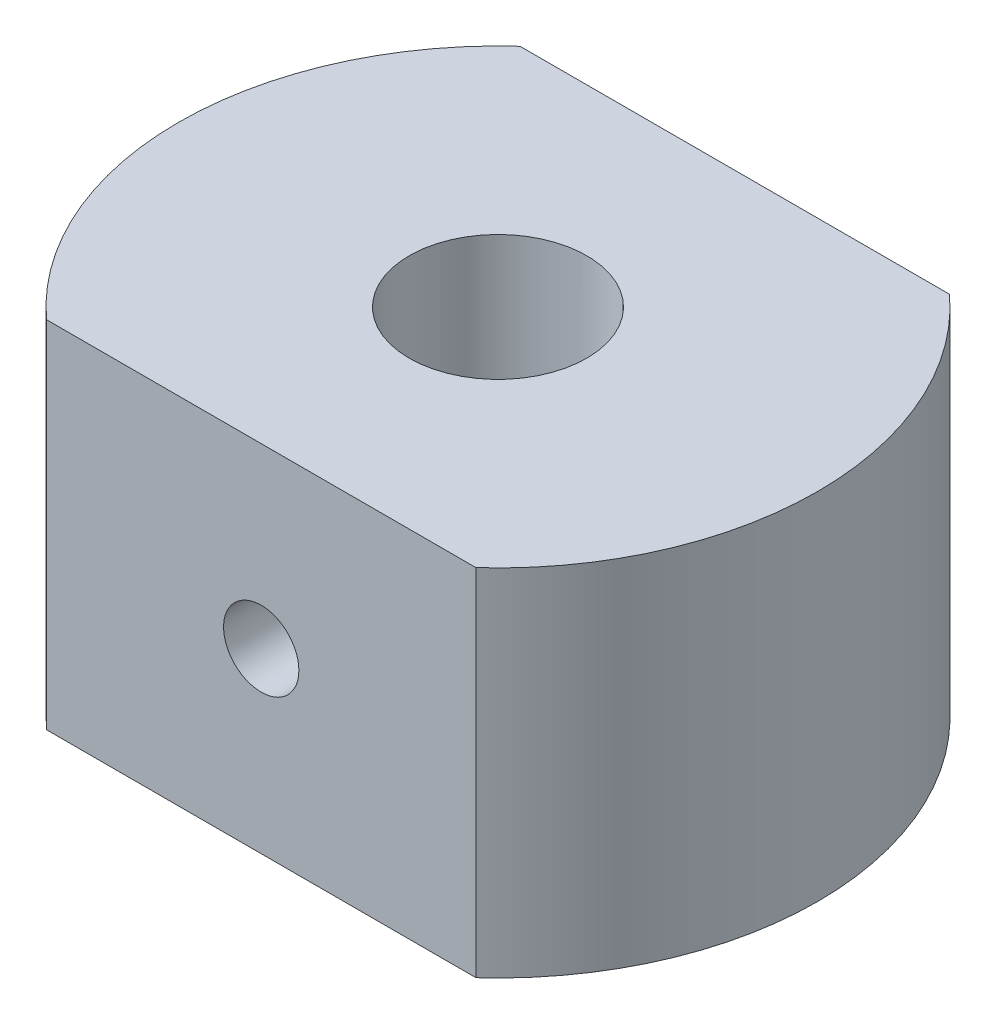
from build123d import *

# Parameters (mm, degrees)
SKETCH1_R                 = 17.145
BOSS_EXTRUDE1_DEPTH       = 19.05
SKETCH2_R                 = 4.7625
CUT_EXTRUDE1_DEPTH        = 31.835118777
SKETCH3_R                 = 2.0193
F_10_32_TAPPED_HOLE_DEPTH = 50.8
SKETCH4_OUTSIDE_W         = 46.71
SKETCH4_OUTSIDE_H         = 46.71
SKETCH4_OUTSIDE_W_2       = 34.29
SKETCH4_OUTSIDE_H_2       = 25.4
FIT_IN_SLOT_DEPTH         = 31.83511895


with BuildPart() as part:
    # Sketch1 → Boss-Extrude1 (new body)
    with BuildSketch(Plane(origin=(0, 0, 0), x_dir=(1, 0, 0), z_dir=(0, 1, 0))):
        with Locations(Location((0, 0, 0), (0, 0, 90))):
            Circle(SKETCH1_R)
    extrude(amount=BOSS_EXTRUDE1_DEPTH)

    # Sketch2 → Cut-Extrude1 (cut, through all)
    with BuildSketch(Plane(origin=(0, 19.05, 0), x_dir=(1, 0, 0), z_dir=(0, 1, 0))):
        with Locations(Location((0, 0, 0), (0, 0, 270))):
            Circle(SKETCH2_R)
    extrude(amount=-CUT_EXTRUDE1_DEPTH, mode=Mode.SUBTRACT)

    # Sketch3 → 10-32 Tapped Hole (cut, symmetric)
    with BuildSketch(Plane.XY):
        with Locations((0, 9.525)):
            Circle(SKETCH3_R)
    extrude(amount=F_10_32_TAPPED_HOLE_DEPTH, both=True, mode=Mode.SUBTRACT)

    # Sketch4 outside → Fit in Slot (cut, through all)
    with BuildSketch(Plane(origin=(0, 19.05, 0), x_dir=(1, 0, 0), z_dir=(0, 1, 0))):
        Rectangle(SKETCH4_OUTSIDE_W, SKETCH4_OUTSIDE_H)
        Rectangle(SKETCH4_OUTSIDE_W_2, SKETCH4_OUTSIDE_H_2, mode=Mode.SUBTRACT)
    extrude(amount=-FIT_IN_SLOT_DEPTH, mode=Mode.SUBTRACT)


solid = part.part
